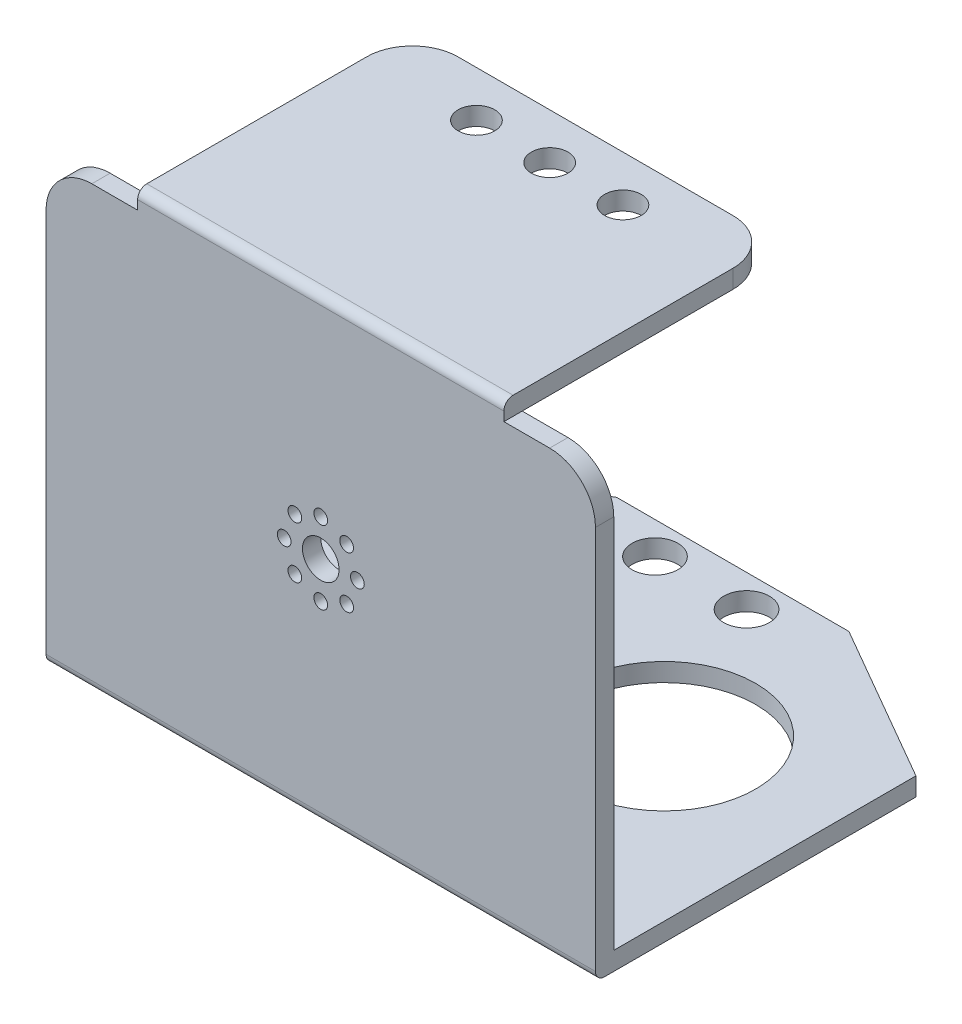
from build123d import *

# Parameters (mm, degrees)
EXTRUDE_1_DEPTH     = 2
EXTRUDE_START       = -2
SKETCH_2_W          = 60
SKETCH_2_H          = 2
EXTRUDE_2_DEPTH     = 50
FILLET_1_R          = 1
SKETCH_3_W          = 20
SKETCH_3_H          = 2
EXTRUDE_4_DEPTH     = 30
SKETCH_3_3_W        = 10
SKETCH_3_3_H        = 2
CUT_EXTRUDE_1_DEPTH = 30
FILLET_4_R          = 5
FILLET_5_R          = 1
SKETCH_4_R          = 2
CUT_EXTRUDE_2_DEPTH = 30
FILLET_6_R          = 5
SKETCH_5_R          = 2.5
SKETCH_5_R_2        = 10
CUT_EXTRUDE_4_DEPTH = 30
SKETCH_6_R          = 2.5
CUT_EXTRUDE_5_DEPTH = 10
SKETCH_7_R          = 2
SKETCH_7_R_2        = 0.75
CUT_EXTRUDE_6_DEPTH = 10


with BuildPart() as part:
    # 草图1 → 凸台-拉伸1 (new body)
    with BuildSketch(Plane(origin=(0, 0, 0), x_dir=(1, 0, 0), z_dir=(0, 1, 0))):
        Polygon((-12.679491924, 0), (12.679491924, 0), (30, -10), (30, -45), (-30, -45), (-30, -10), align=None)
    extrude(amount=EXTRUDE_1_DEPTH)

    # 草图2 → 凸台-拉伸2 (add)
    with BuildSketch(Plane(origin=(0, 2, 0), x_dir=(1, 0, 0), z_dir=(0, 1, 0)).offset(EXTRUDE_START)):
        with Locations((0, -44)):
            Rectangle(SKETCH_2_W, SKETCH_2_H)
    extrude(amount=EXTRUDE_2_DEPTH)

    # 圆角1
    fillet_1_edges = [part.edges().sort_by_distance(p)[0] for p in [
        (0, 0, 45),
    ]]
    fillet(fillet_1_edges, radius=FILLET_1_R)

    # 草图3 → 凸台-拉伸4 (add)
    with BuildSketch(Plane(origin=(0, 0, 43), x_dir=(-1, 0, 0), z_dir=(0, 0, -1)).offset(EXTRUDE_START)):
        with Locations((-10, 49)):
            Rectangle(SKETCH_3_W, SKETCH_3_H)
        with Locations((10, 49)):
            Rectangle(SKETCH_3_W, SKETCH_3_H)
    extrude(amount=EXTRUDE_4_DEPTH)

    # 草图3<3> → 切除-拉伸1 (cut)
    with BuildSketch(Plane(origin=(0, 0, 43), x_dir=(-1, 0, 0), z_dir=(0, 0, -1))):
        with Locations((-25, 49)):
            Rectangle(SKETCH_3_3_W, SKETCH_3_3_H)
        with Locations((25, 49)):
            Rectangle(SKETCH_3_3_W, SKETCH_3_3_H)
    extrude(amount=-CUT_EXTRUDE_1_DEPTH, mode=Mode.SUBTRACT)

    # 圆角4
    fillet_4_edges = [part.edges().sort_by_distance(p)[0] for p in [
        (30, 48, 44),
        (-30, 48, 44),
    ]]
    fillet(fillet_4_edges, radius=FILLET_4_R)

    # 圆角5
    fillet_5_edges = [part.edges().sort_by_distance(p)[0] for p in [
        (0, 50, 45),
    ]]
    fillet(fillet_5_edges, radius=FILLET_5_R)

    # 草图4 → 切除-拉伸2 (cut)
    with BuildSketch(Plane(origin=(0, 50, 0), x_dir=(1, 0, 0), z_dir=(0, 1, 0))):
        with Locations(Location((0, -20, 0), (0, 0, 270))):
            Circle(SKETCH_4_R)
        with Locations(Location((-8, -20, 0), (0, 0, 270))):
            Circle(SKETCH_4_R)
        with Locations(Location((8, -20, 0), (0, 0, 270))):
            Circle(SKETCH_4_R)
    extrude(amount=-CUT_EXTRUDE_2_DEPTH, mode=Mode.SUBTRACT)

    # 圆角6
    fillet_6_edges = [part.edges().sort_by_distance(p)[0] for p in [
        (-20, 49, 15),
        (20, 49, 15),
    ]]
    fillet(fillet_6_edges, radius=FILLET_6_R)

    # 草图5 → 切除-拉伸4 (cut)
    with BuildSketch(Plane.XZ):
        with Locations(Location((-12.5, 20, 0), (0, 0, 270))):
            Circle(SKETCH_5_R)
        with Locations(Location((12.5, 20, 0), (0, 0, 270))):
            Circle(SKETCH_5_R_2)
    extrude(amount=-CUT_EXTRUDE_4_DEPTH, mode=Mode.SUBTRACT)

    # 草图6 → 切除-拉伸5 (cut)
    with BuildSketch(Plane(origin=(0, 2, 0), x_dir=(1, 0, 0), z_dir=(0, 1, 0))):
        with Locations(Location((5, -3.5, 0), (0, 0, 270))):
            Circle(SKETCH_6_R)
        with Locations(Location((-5, -3.5, 0), (0, 0, 270))):
            Circle(SKETCH_6_R)
    extrude(amount=-CUT_EXTRUDE_5_DEPTH, mode=Mode.SUBTRACT)

    # 草图7 → 切除-拉伸6 (cut)
    with BuildSketch(Plane.XY.offset(45)):
        with Locations((0, 25)):
            Circle(SKETCH_7_R)
        with Locations((0, 29)):
            Circle(SKETCH_7_R_2)
        with Locations((2.828427125, 27.828427125)):
            Circle(SKETCH_7_R_2)
        with Locations((4, 25)):
            Circle(SKETCH_7_R_2)
        with Locations((2.828427125, 22.171572875)):
            Circle(SKETCH_7_R_2)
        with Locations((0, 21)):
            Circle(SKETCH_7_R_2)
        with Locations((-2.828427125, 22.171572875)):
            Circle(SKETCH_7_R_2)
        with Locations((-4, 25)):
            Circle(SKETCH_7_R_2)
        with Locations((-2.828427125, 27.828427125)):
            Circle(SKETCH_7_R_2)
    extrude(amount=-CUT_EXTRUDE_6_DEPTH, mode=Mode.SUBTRACT)


solid = part.part
